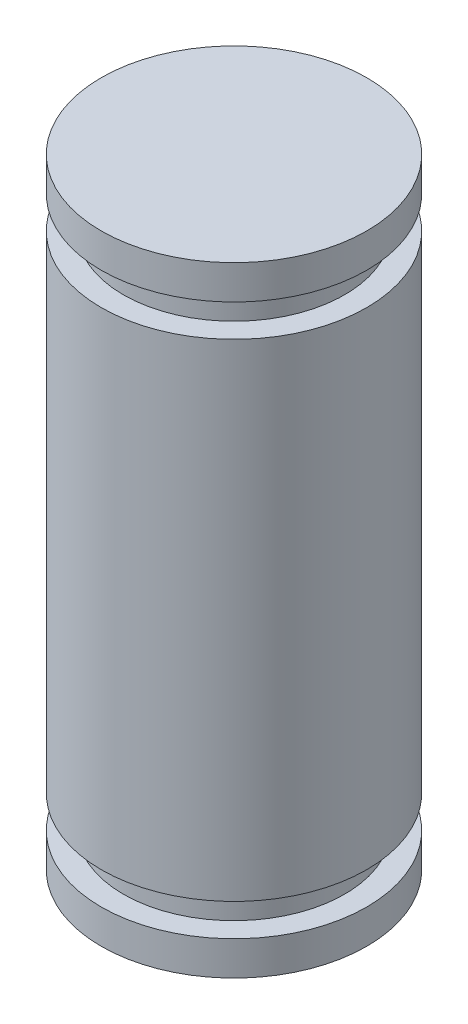
from build123d import *


with BuildPart() as part:
    # Sketch1 → Revolve1 (revolve)
    with BuildSketch(Plane.XY, mode=Mode.PRIVATE) as revolve1_sk:
        Polygon((0, 1.5), (0, 12.5), (-0.5, 12.5), (-0.5, 13.23), (0, 13.23), (0, 14), (-3, 14), (-3, 0), (0, 0), (0, 0.77), (-0.5, 0.77), (-0.5, 1.5), align=None)
    revolve(revolve1_sk.sketch.rotate(Axis((-3, 14, 0), (0, -1, 0)), 90), axis=Axis((-3, 14, 0), (0, -1, 0)))


solid = part.part
